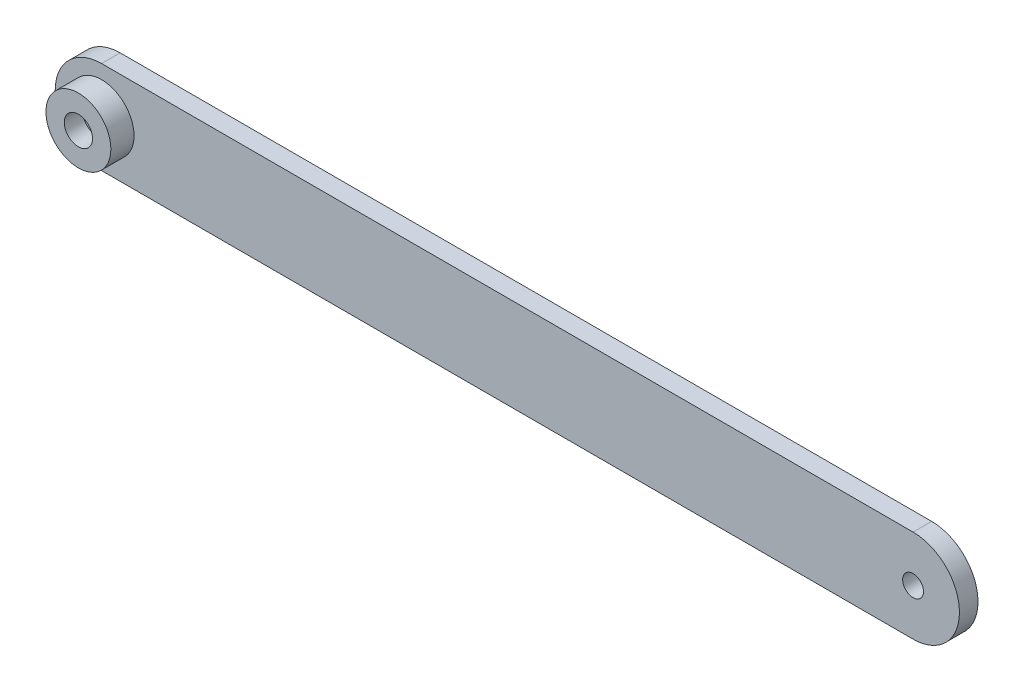
from build123d import *

# Parameters (mm, degrees)
SKETCH1_R           = 2.25
SKETCH1_R_2         = 1
BOSS_EXTRUDE1_DEPTH = 2
SKETCH4_R           = 7
SKETCH4_R_2         = 1
BOSS_EXTRUDE2_DEPTH = 1
SKETCH5_R           = 7
SKETCH5_R_2         = 3.05
BOSS_EXTRUDE3_DEPTH = 4
CUT_EXTRUDE1_DEPTH  = 3


with BuildPart() as part:
    # Sketch1 → Boss-Extrude1 (new, symmetric)
    with BuildSketch(Plane.XY):
        with BuildLine():
            Line((0, 10), (175, 10))
            ThreePointArc((175, 10), (185, 0), (175, -10))
            Line((175, -10), (0, -10))
            ThreePointArc((0, -10), (-10, 0), (0, 10))
        make_face()
        with Locations((175, 0)):
            Circle(SKETCH1_R, mode=Mode.SUBTRACT)
        with Locations((8.098e-06, -5.598e-06)):
            Circle(SKETCH1_R_2, mode=Mode.SUBTRACT)
    extrude(amount=BOSS_EXTRUDE1_DEPTH, both=True)

    # Sketch4 → Boss-Extrude2 (add)
    with BuildSketch(Plane.XY.offset(2)):
        with Locations((8.098e-06, -5.598e-06)):
            Circle(SKETCH4_R)
        with Locations((8.098e-06, -5.598e-06)):
            Circle(SKETCH4_R_2, mode=Mode.SUBTRACT)
    extrude(amount=BOSS_EXTRUDE2_DEPTH)

    # Sketch5 → Boss-Extrude3 (add)
    with BuildSketch(Plane.XY.offset(3)):
        with Locations((8.098e-06, -5.598e-06)):
            Circle(SKETCH5_R)
        with Locations((8.098e-06, -5.598e-06)):
            Circle(SKETCH5_R_2, mode=Mode.SUBTRACT)
    extrude(amount=BOSS_EXTRUDE3_DEPTH)

    # Sketch6 → Cut-Extrude1 (cut)
    with BuildSketch(Plane(origin=(0, 0, -2), x_dir=(-1, 0, 0), z_dir=(0, 0, -1))):
        Polygon((-0.324730573, 2.050263829), (0, 2.374994402), (0.324730573, 2.050261264), (0.733914965, 2.258751125), (0.942404034, 1.849564293), (1.395988428, 1.921405003), (1.46782763, 1.467818534), (1.921412023, 1.395977824), (1.849569238, 0.942391923), (2.25875363, 0.733902061), (2.050261329, 0.324716876), (2.374991902, -1.3697e-05), (2.050258764, -0.324744269), (2.258748625, -0.733928662), (1.849561793, -0.942417731), (1.921402503, -1.396002124), (1.467816034, -1.467841327), (1.395975324, -1.92142572), (0.942389423, -1.849582934), (0.733899561, -2.258767327), (0.324714376, -2.050275026), (-1.6197e-05, -2.375005598), (-0.324746769, -2.05027246), (-0.733931162, -2.258762322), (-0.942420231, -1.84957549), (-1.396004624, -1.9214162), (-1.467843827, -1.467829731), (-1.92142822, -1.395989021), (-1.849585434, -0.94240312), (-2.258769827, -0.733913258), (-2.050277526, -0.324728073), (-2.375008098, 2.5e-06), (-2.05027496, 0.324733073), (-2.258764822, 0.733917465), (-1.84957799, 0.942406534), (-1.9214187, 1.395990928), (-1.467832231, 1.46783013), (-1.395991521, 1.921414523), (-0.94240562, 1.849571738), (-0.733915758, 2.25875613), align=None)
    extrude(amount=-CUT_EXTRUDE1_DEPTH, mode=Mode.SUBTRACT)


solid = part.part
